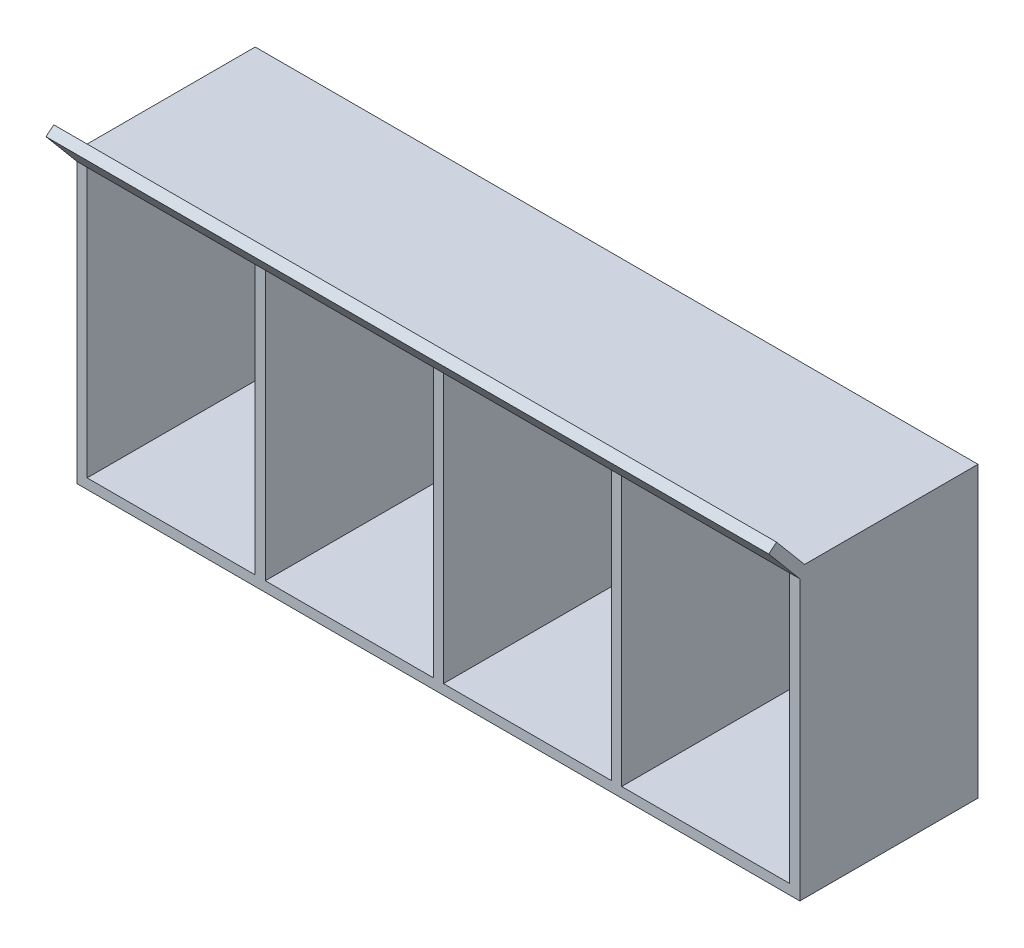
from build123d import *

# Parameters (mm, degrees)
ESBO_O1_W                = 50
ESBO_O1_H                = 80
RESSALTO_EXTRUS_O1_DEPTH = 50
ESBO_O2_W                = 215
ESBO_O2_H                = 86
RESSALTO_EXTRUS_O2_DEPTH = 3
RESSALTO_EXTRUS_O3_DEPTH = 215


with BuildPart() as part:
    # Esboço1 → Ressalto-extrusão1 (new body)
    # profile 1 of 2: a face of its own
    with BuildSketch(Plane.XY):
        Polygon((53, 86), (0, 86), (0, 0), (53, 0), (56, 0), (56, 3), (56, 83), (56, 86), align=None)
        with Locations((28, 43)):
            Rectangle(ESBO_O1_W, ESBO_O1_H, mode=Mode.SUBTRACT)
    # profile 2 of 2: a face of its own
    with BuildSketch(Plane.XY):
        Polygon((215, 86), (56, 86), (56, 83), (106, 83), (106, 3), (56, 3), (56, 0), (215, 0), (215, 3), (215, 83), align=None)
        with Locations((134, 43)):
            Rectangle(ESBO_O1_W, ESBO_O1_H, mode=Mode.SUBTRACT)
        with Locations((187, 43)):
            Rectangle(ESBO_O1_W, ESBO_O1_H, mode=Mode.SUBTRACT)
    extrude(amount=RESSALTO_EXTRUS_O1_DEPTH)

    # Esboço2 → Ressalto-extrusão2 (add)
    with BuildSketch(Plane(origin=(0, 0, 0), x_dir=(-1, 0, 0), z_dir=(0, 0, -1))):
        with Locations((-107.5, 43)):
            Rectangle(ESBO_O2_W, ESBO_O2_H)
    extrude(amount=RESSALTO_EXTRUS_O2_DEPTH)

    # Esboço4 → Ressalto-extrusão3 (add)
    with BuildSketch(Plane(origin=(215, 0, 0), x_dir=(0, 0, -1), z_dir=(1, 0, 0))):
        Polygon((-59.230095943, 94), (-56.931962614, 95.928362829), (-48.601077026, 86), (-50, 86), (-50, 83), align=None)
    extrude(amount=-RESSALTO_EXTRUS_O3_DEPTH)


solid = part.part
